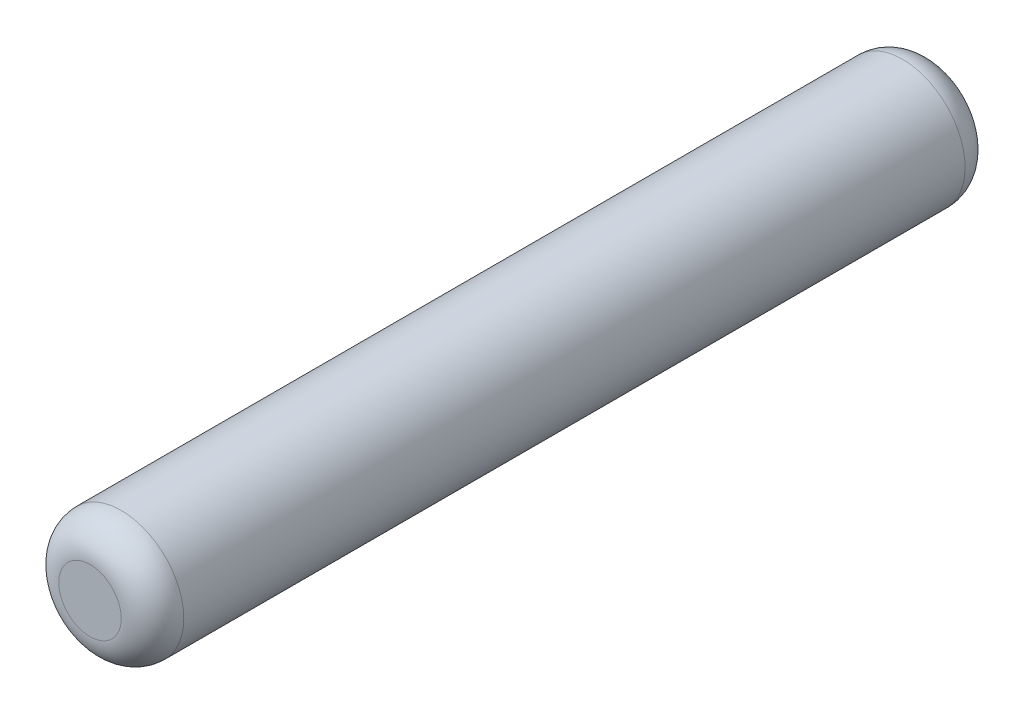
from build123d import *

# Parameters (mm, degrees)
ESQUISSE1_R          = 2
BASE_EXTRUSION_DEPTH = 27
CONG_1_R             = 1


with BuildPart() as part:
    # Esquisse1 → Base-Extrusion (new body)
    with BuildSketch(Plane.XY):
        Circle(ESQUISSE1_R)
    extrude(amount=BASE_EXTRUSION_DEPTH)

    # Congé1
    cong_1_edges = [part.edges().sort_by_distance(p)[0] for p in [
        (-2, 0, 0),
        (-2, 0, 27),
    ]]
    fillet(cong_1_edges, radius=CONG_1_R)


solid = part.part
